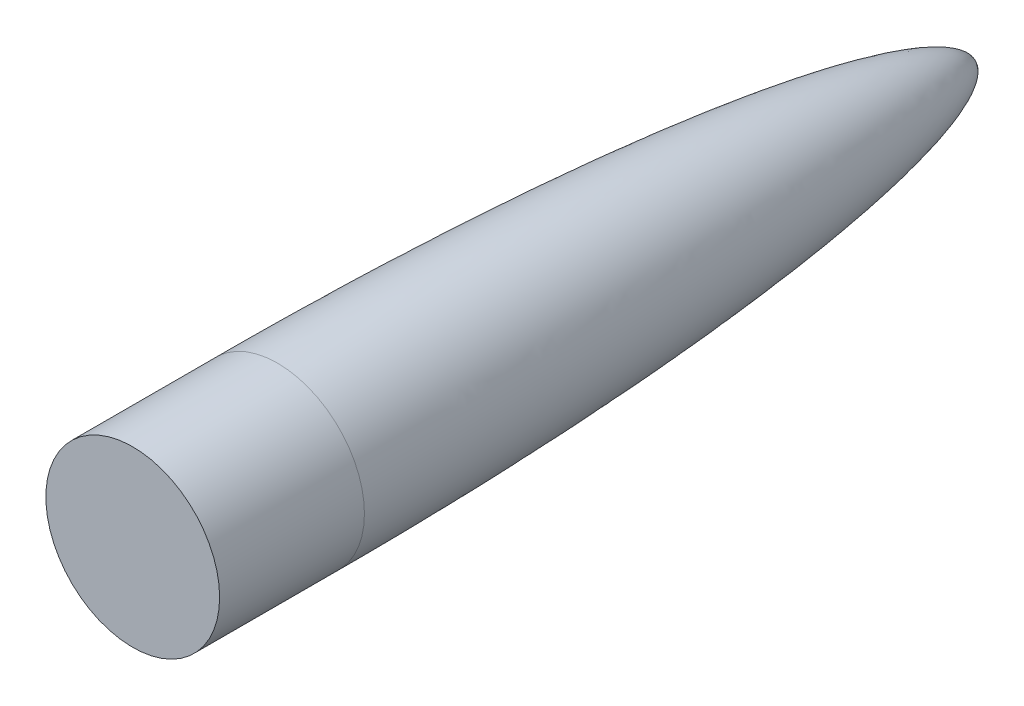
from build123d import *

# Parameters (mm, degrees)
SKETCH2_R           = 76.2
BOSS_EXTRUDE1_DEPTH = 127


with BuildPart() as part:
    # Sketch1 → Revolve1 (revolve)
    with BuildSketch(Plane(origin=(0, 0, 0), x_dir=(0, 0, -1), z_dir=(1, 0, 0))):
        with BuildLine():
            Line((0, 76.2), (0, 0))
            Line((0, 0), (609.6, 0))
            add(Edge.make_bspline(
                [(0, 76.2), (1.334839127, 76.2), (4.025294656, 76.198825967), (10.555315298, 76.19178178), (18.864059538, 76.167123171), (29.417628107, 76.117787061), (40.965227515, 76.033133769), (52.78542989, 75.920119568), (64.450855104, 75.778619132), (76.201774547, 75.608477807), (90.836898521, 75.359759732), (108.426630228, 75.003190064), (128.928201741, 74.50130726), (152.366814588, 73.807280443), (172.865959474, 73.091665079), (190.437128474, 72.398352623), (208.00364725, 71.639189664), (231.422760316, 70.537435589), (263.612501761, 68.799602068), (304.556456434, 66.151537199), (351.300725766, 62.443633194), (397.975224103, 57.931340388), (438.723008806, 53.110136512), (473.542663933, 48.15193198), (501.685686908, 43.401720584), (523.199490669, 39.241498072), (544.34948081, 34.489348514), (562.960195372, 29.481918023), (578.458973018, 24.329540963), (590.075652245, 19.334897623), (597.076898444, 15.510808376), (601.388134479, 12.573206028), (604.148746676, 10.252323678), (605.978811573, 8.365191325), (607.233296472, 6.773743467), (608.121671405, 5.370509631), (608.765687549, 4.066708422), (609.29755338, 2.594881785), (609.53411228, 1.409283445), (609.599563682, 0.541918222), (609.6, 0)],
                knots=[0.089027133, 0.089027133, 0.089027133, 0.089027133, 0.089027133, 0.097586656, 0.106146178, 0.123265223, 0.140384268, 0.157503313, 0.174622357, 0.191741402, 0.208860447, 0.225979492, 0.260217581, 0.294455671, 0.328693761, 0.36293185, 0.380050895, 0.39716994, 0.43140803, 0.499884208, 0.568360387, 0.636836565, 0.705312743, 0.773788919, 0.808027005, 0.842265092, 0.872021499, 0.901777906, 0.93462815, 0.954806841, 0.967334402, 0.975548193, 0.981160159, 0.985233135, 0.988367336, 0.990878441, 0.992977119, 0.994917714, 0.996846243, 1, 1, 1, 1, 1], degree=4))
        make_face()
    revolve(axis=Axis((0, 0, -480.06), (0, 0, 1)))

    # Sketch2 → Boss-Extrude1 (add)
    with BuildSketch(Plane.XY):
        Circle(SKETCH2_R)
    extrude(amount=BOSS_EXTRUDE1_DEPTH)


solid = part.part
